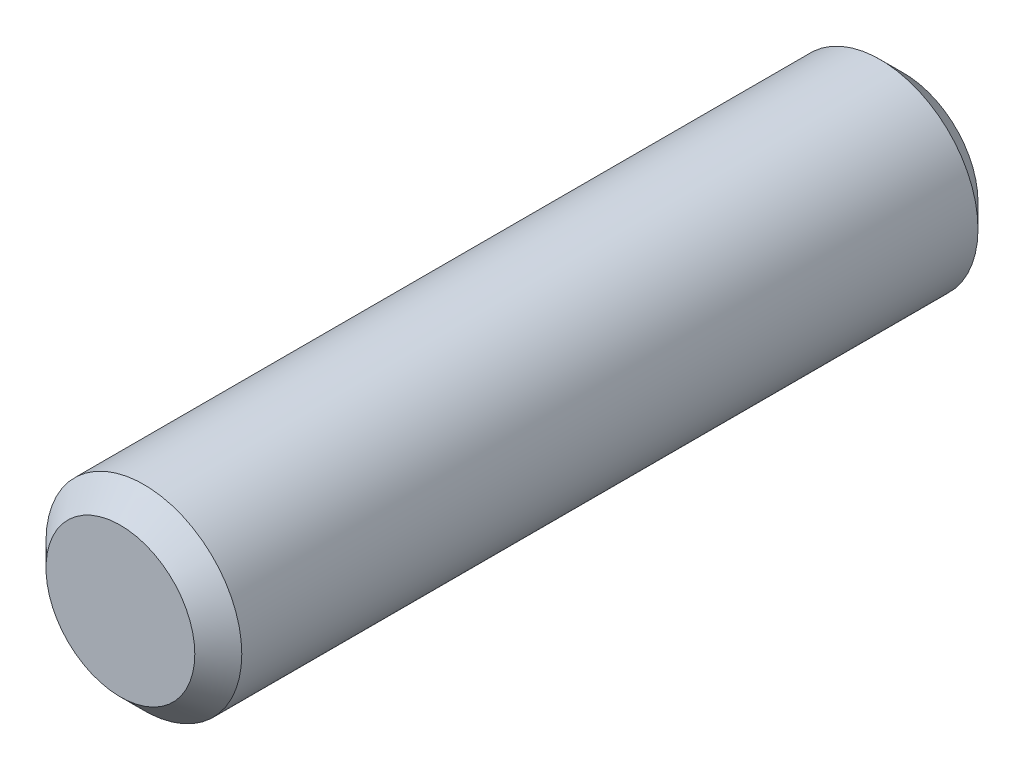
from build123d import *

# Parameters (mm, degrees)
SKETCH1_R           = 3.175
BOSS_EXTRUDE1_DEPTH = 25.4
CHAMFER1_SIZE       = 0.762


with BuildPart() as part:
    # Sketch1 → Boss-Extrude1 (new body)
    with BuildSketch(Plane.XY):
        Circle(SKETCH1_R)
    extrude(amount=BOSS_EXTRUDE1_DEPTH)

    # Chamfer1
    chamfer1_edges = [part.edges().sort_by_distance(p)[0] for p in [
        (-3.175, 0, 0),
        (-3.175, 0, 25.4),
    ]]
    chamfer(chamfer1_edges, length=CHAMFER1_SIZE)


solid = part.part
